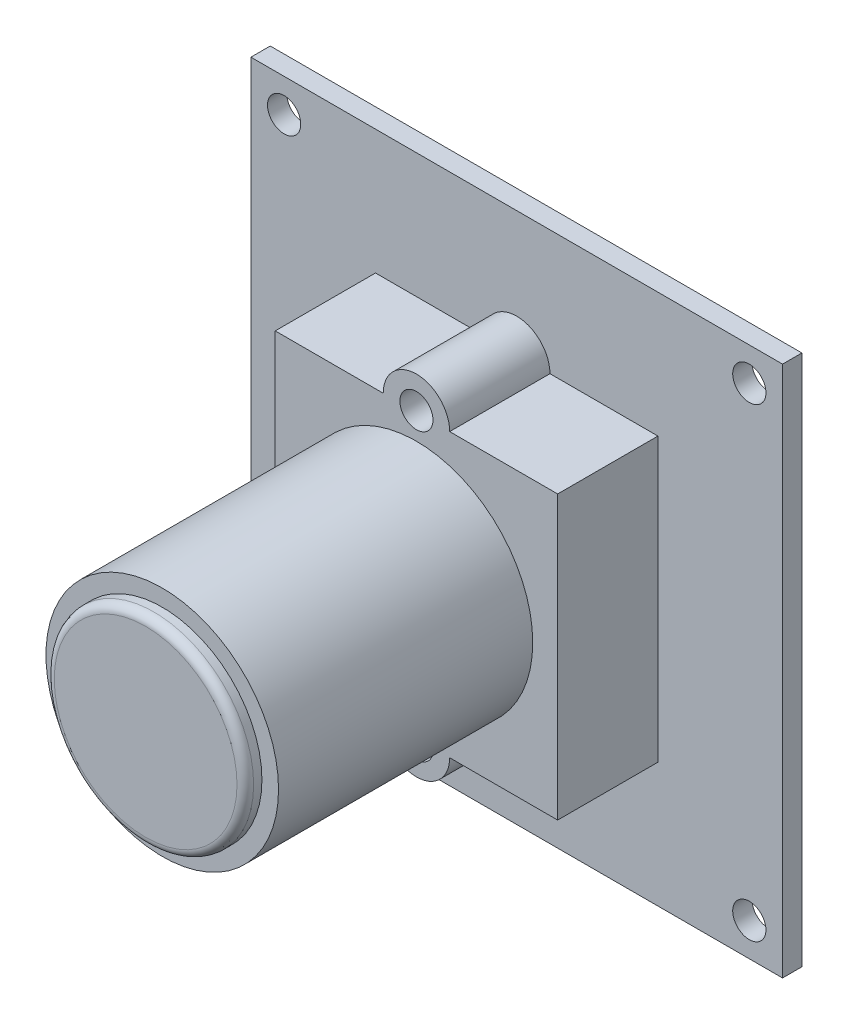
from build123d import *

# Parameters (mm, degrees)
SKETCH1_R           = 7
BOSS_EXTRUDE1_DEPTH = 15.3
SKETCH2_R           = 6
BOSS_EXTRUDE2_DEPTH = 1
FILLET1_R           = 0.5
SKETCH3_W           = 1.163915396
SKETCH3_H           = 32
BOSS_EXTRUDE3_DEPTH = 16
SKETCH4_W           = 17
SKETCH4_H           = 17
BOSS_EXTRUDE4_DEPTH = 6.036084604
SKETCH5_R           = 1
CUT_EXTRUDE1_DEPTH  = 4
SKETCH6_R           = 2
BOSS_EXTRUDE5_DEPTH = 6.036084604
SKETCH7_R           = 0.995331294
SKETCH7_R_2         = 1.011185122
CUT_EXTRUDE2_DEPTH  = 4


with BuildPart() as part:
    # Sketch1 → Boss-Extrude1 (new body)
    with BuildSketch(Plane.XY):
        Circle(SKETCH1_R)
    extrude(amount=BOSS_EXTRUDE1_DEPTH)

    # Sketch2 → Boss-Extrude2 (add)
    with BuildSketch(Plane.XY.offset(15.3)):
        Circle(SKETCH2_R)
    extrude(amount=BOSS_EXTRUDE2_DEPTH)

    # Fillet1
    fillet1_edges = [part.edges().sort_by_distance(p)[0] for p in [
        (-6, 0, 16.3),
    ]]
    fillet(fillet1_edges, radius=FILLET1_R)



with BuildPart() as body_2:
    # Sketch3 → Boss-Extrude3 (new, symmetric)
    with BuildSketch(Plane(origin=(0, 0, 0), x_dir=(0, 0, -1), z_dir=(1, 0, 0))):
        with Locations((6.618042302, 0)):
            Rectangle(SKETCH3_W, SKETCH3_H)
    extrude(amount=BOSS_EXTRUDE3_DEPTH, both=True)


with BuildPart() as part_1:
    add(part.part)

    add(body_2.part)  # Boss-Extrude4 merges body 2
    # Sketch4 → Boss-Extrude4 (add)
    with BuildSketch(Plane.XY.offset(-6.036084604)):
        Rectangle(SKETCH4_W, SKETCH4_H)
    extrude(amount=BOSS_EXTRUDE4_DEPTH)

    # Sketch5 → Cut-Extrude1 (cut)
    with BuildSketch(Plane.XY.offset(-6.036084604)):
        with Locations((-14, 14)):
            Circle(SKETCH5_R)
        with Locations((14, 14)):
            Circle(SKETCH5_R)
        with Locations((14, -14)):
            Circle(SKETCH5_R)
        with Locations((-14, -14)):
            Circle(SKETCH5_R)
    extrude(amount=-CUT_EXTRUDE1_DEPTH, mode=Mode.SUBTRACT)

    # Sketch6 → Boss-Extrude5 (add)
    with BuildSketch(Plane.XY):
        with Locations((0, 8.5)):
            Circle(SKETCH6_R)
        with Locations((0, -8.5)):
            Circle(SKETCH6_R)
    extrude(amount=-BOSS_EXTRUDE5_DEPTH)

    # Sketch7 → Cut-Extrude2 (cut)
    with BuildSketch(Plane.XY):
        with Locations((0, 8.595073535)):
            Circle(SKETCH7_R)
        with Locations((0, -8.595073535)):
            Circle(SKETCH7_R_2)
    extrude(amount=-CUT_EXTRUDE2_DEPTH, mode=Mode.SUBTRACT)


solid = part_1.part
